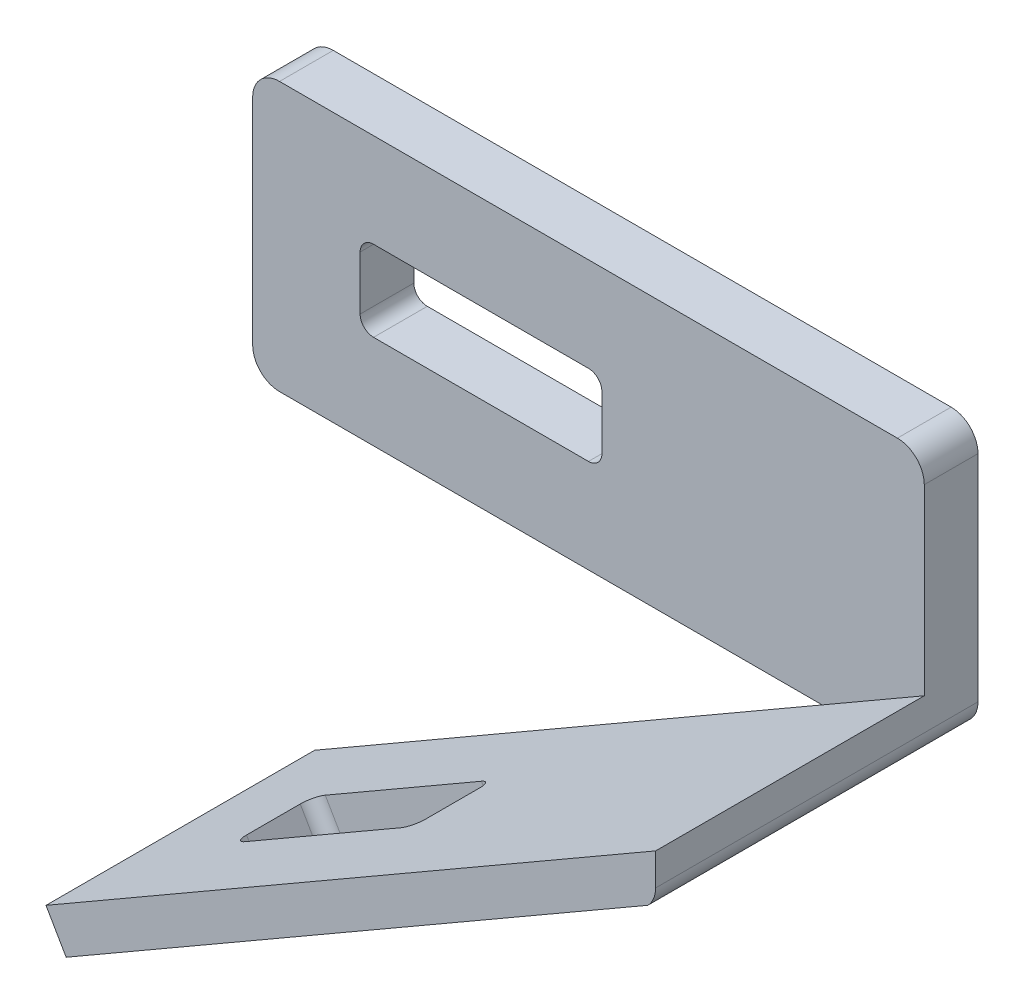
from build123d import *

# Parameters (mm, degrees)
BOSS_EXTRU_1_DEPTH      = 4
ENL_V_MAT_EXTRU_1_DEPTH = 50
BOSS_EXTRU_2_DEPTH      = 20
ENL_V_MAT_EXTRU_2_REACH = 47.943


with BuildPart() as part:
    # Esquisse1 → Boss.-Extru.1 (new body)
    with BuildSketch(Plane.XY):
        with BuildLine():
            Line((-11.273273273, 8.708708709), (34.726726727, 8.708708709))
            ThreePointArc((34.726726727, 8.708708709), (36.140940289, 8.122922271), (36.726726727, 6.708708709))
            Line((36.726726727, 6.708708709), (36.726726727, -9.291291291))
            ThreePointArc((36.726726727, -9.291291291), (36.140940289, -10.705504854), (34.726726727, -11.291291291))
            Line((34.726726727, -11.291291291), (-11.273273273, -11.291291291))
            ThreePointArc((-11.273273273, -11.291291291), (-12.687486836, -10.705504854), (-13.273273273, -9.291291291))
            Line((-13.273273273, -9.291291291), (-13.273273273, 6.708708709))
            ThreePointArc((-13.273273273, 6.708708709), (-12.687486836, 8.122922271), (-11.273273273, 8.708708709))
        make_face()
    extrude(amount=BOSS_EXTRU_1_DEPTH)

    # Esquisse3 → Enlèv. mat.-Extru.1 (cut)
    with BuildSketch(Plane.XY.offset(4)):
        with BuildLine():
            Line((-4.273273273, 1.708708709), (11.726726727, 1.708708709))
            ThreePointArc((11.726726727, 1.708708709), (12.433833508, 1.41581549), (12.726726727, 0.708708709))
            Line((12.726726727, 0.708708709), (12.726726727, -3.291291291))
            ThreePointArc((12.726726727, -3.291291291), (12.433833508, -3.998398072), (11.726726727, -4.291291291))
            Line((11.726726727, -4.291291291), (-4.273273273, -4.291291291))
            ThreePointArc((-4.273273273, -4.291291291), (-4.980380054, -3.998398072), (-5.273273273, -3.291291291))
            Line((-5.273273273, -3.291291291), (-5.273273273, 0.708708709))
            ThreePointArc((-5.273273273, 0.708708709), (-4.980380054, 1.41581549), (-4.273273273, 1.708708709))
        make_face()
    extrude(amount=-ENL_V_MAT_EXTRU_1_DEPTH, mode=Mode.SUBTRACT)

    # Esquisse4 → Boss.-Extru.2 (add)
    with BuildSketch(Plane.XY.offset(4)):
        with BuildLine():
            Line((36.141746361, -10.704698322), (-7.159396677, -35.704918553))
            Line((-7.159396677, -35.704918553), (-8.659409891, -33.10684997))
            Line((-8.659409891, -33.10684997), (36.726726727, -6.902843996))
            Line((36.726726727, -6.902843996), (36.726726727, -9.291291291))
            ThreePointArc((36.726726727, -9.291291291), (36.5747039, -10.056131383), (36.141746361, -10.704698322))
        make_face()
    extrude(amount=BOSS_EXTRU_2_DEPTH)

    # Esquisse5 → Enlèv. mat.-Extru.2 (cut, up to next)
    with BuildSketch(Plane(origin=(12.170880133, -21.08033516, 0), x_dir=(0.8660228607631385, 0.500004404616229, 0), z_dir=(-0.500004404616229, 0.8660228607631385, 0)), mode=Mode.PRIVATE) as enl_v_mat_extru_2_sk1:
        with BuildLine():
            Line((-15.052817734, -11), (-1.632555066, -11))
            ThreePointArc((-1.632555066, -11), (-0.925448284, -11.292893219), (-0.632555066, -12))
            Line((-0.632555066, -12), (-0.632555066, -16))
            ThreePointArc((-0.632555066, -16), (-0.925448284, -16.707106781), (-1.632555066, -17))
            Line((-1.632555066, -17), (-15.052817734, -17))
            ThreePointArc((-15.052817734, -17), (-15.759924515, -16.707106781), (-16.052817734, -16))
            Line((-16.052817734, -16), (-16.052817734, -12))
            ThreePointArc((-16.052817734, -12), (-15.759924515, -11.292893219), (-15.052817734, -11))
        make_face()
    enl_v_mat_extru_2_tool1 = extrude(enl_v_mat_extru_2_sk1.sketch, amount=-ENL_V_MAT_EXTRU_2_REACH, mode=Mode.PRIVATE) & part.part
    add(enl_v_mat_extru_2_tool1.solids().sort_by_distance((4.945923, -25.251715, 14))[0], mode=Mode.SUBTRACT)


solid = part.part
